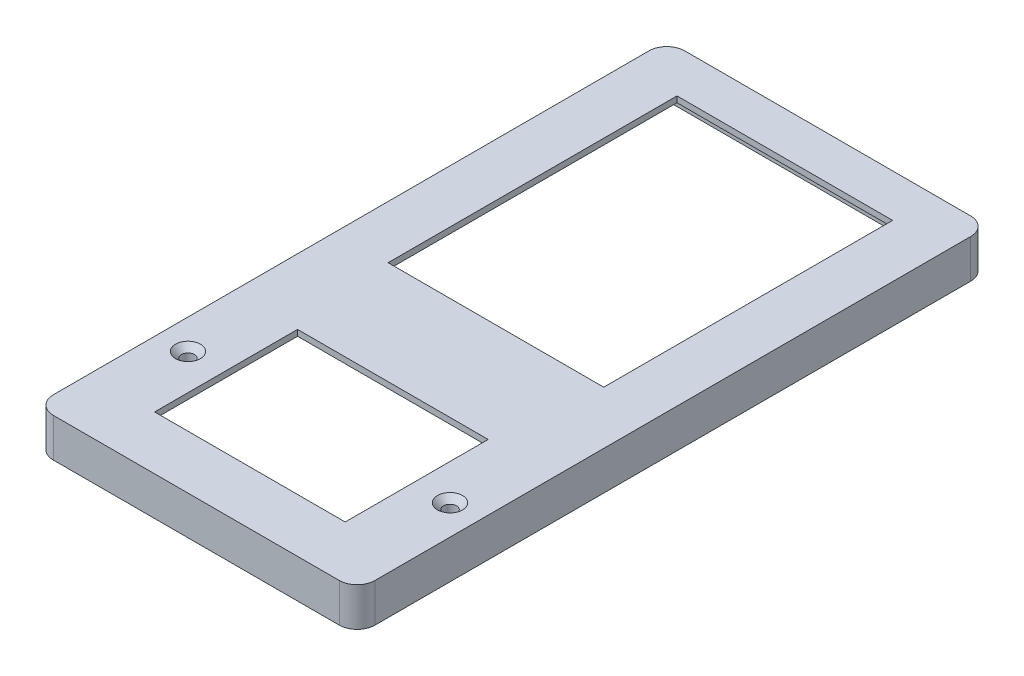
from build123d import *

# Parameters (mm, degrees)
SKETCH1_W           = 54
SKETCH1_H           = 106
SKETCH1_W_2         = 49.5
SKETCH1_H_2         = 101.5
BOSS_EXTRUDE1_DEPTH = 5.5
SKETCH2_W           = 54
SKETCH2_H           = 106
SKETCH2_W_2         = 36.2
SKETCH2_H_2         = 48.5
SKETCH2_W_3         = 32
SKETCH2_H_3         = 24
BOSS_EXTRUDE2_DEPTH = 1
BOSS_EXTRUDE3_DEPTH = 2
SKETCH4_R           = 3
BOSS_EXTRUDE4_DEPTH = 2
SKETCH5_R           = 1.1
CUT_EXTRUDE1_DEPTH  = 60.73483071
FILLET1_R           = 3
CHAMFER1_SIZE       = 1
SKETCH6_W           = 49.5
SKETCH6_H           = 1
CUT_EXTRUDE2_DEPTH  = 2


with BuildPart() as part:
    # Sketch1 → Boss-Extrude1 (new body)
    with BuildSketch(Plane(origin=(0, 0, 0), x_dir=(1, 0, 0), z_dir=(0, 1, 0))):
        Rectangle(SKETCH1_W, SKETCH1_H)
        Rectangle(SKETCH1_W_2, SKETCH1_H_2, mode=Mode.SUBTRACT)
    extrude(amount=-BOSS_EXTRUDE1_DEPTH)

    # Sketch2 → Boss-Extrude2 (add)
    with BuildSketch(Plane(origin=(0, 0, 0), x_dir=(1, 0, 0), z_dir=(0, 1, 0))):
        Rectangle(SKETCH2_W, SKETCH2_H)
        with Locations((0, 21.55)):
            Rectangle(SKETCH2_W_2, SKETCH2_H_2, mode=Mode.SUBTRACT)
        with Locations((0, -32)):
            Rectangle(SKETCH2_W_3, SKETCH2_H_3, mode=Mode.SUBTRACT)
    extrude(amount=BOSS_EXTRUDE2_DEPTH)

    # Sketch3 → Boss-Extrude3 (add)
    with BuildSketch(Plane.XZ):
        Polygon((21.6, 11.7715), (17.6, 11.7715), (17.6, 15.2715), (25.1, 15.2715), (25.1, -52.4285), (-25.1, -52.4285), (-25.1, 15.2715), (-17.6, 15.2715), (-17.6, 11.7715), (-21.6, 11.7715), (-21.6, -48.9285), (21.6, -48.9285), align=None)
    extrude(amount=BOSS_EXTRUDE3_DEPTH)

    # Sketch4 → Boss-Extrude4 (add)
    with BuildSketch(Plane.XZ):
        with Locations((-22, 32.4)):
            Circle(SKETCH4_R)
    boss_extrude4 = extrude(amount=BOSS_EXTRUDE4_DEPTH)

    # Sketch5 → Cut-Extrude1 (cut, symmetric)
    with BuildSketch(Plane.XZ):
        with Locations(Location((-22, 32.4, 0), (0, 0, 270))):
            Circle(SKETCH5_R)
    cut_extrude1 = extrude(amount=CUT_EXTRUDE1_DEPTH, both=True, mode=Mode.SUBTRACT)

    # Mirror1: Boss-Extrude4, Cut-Extrude1 across plane
    add(boss_extrude4.mirror(Plane(origin=(0, 0, 0), x_dir=(0, 0, 1), z_dir=(1, 0, 0))))
    add(cut_extrude1.mirror(Plane(origin=(0, 0, 0), x_dir=(0, 0, 1), z_dir=(1, 0, 0))), mode=Mode.SUBTRACT)

    # Fillet1
    fillet1_edges = [part.edges().sort_by_distance(p)[0] for p in [
        (-27, -2.25, -53),
        (27, -2.25, -53),
        (27, -2.25, 53),
        (-27, -2.25, 53),
    ]]
    fillet(fillet1_edges, radius=FILLET1_R)

    # Chamfer1
    chamfer1_edges = [part.edges().sort_by_distance(p)[0] for p in [
        (-22, 1, 33.5),
        (22, 1, 33.5),
    ]]
    chamfer(chamfer1_edges, length=CHAMFER1_SIZE)

    # Sketch6 → Cut-Extrude2 (cut)
    with BuildSketch(Plane.XZ.offset(5.5)):
        with Locations((0, 51.25)):
            Rectangle(SKETCH6_W, SKETCH6_H)
    extrude(amount=-CUT_EXTRUDE2_DEPTH, mode=Mode.SUBTRACT)


solid = part.part
